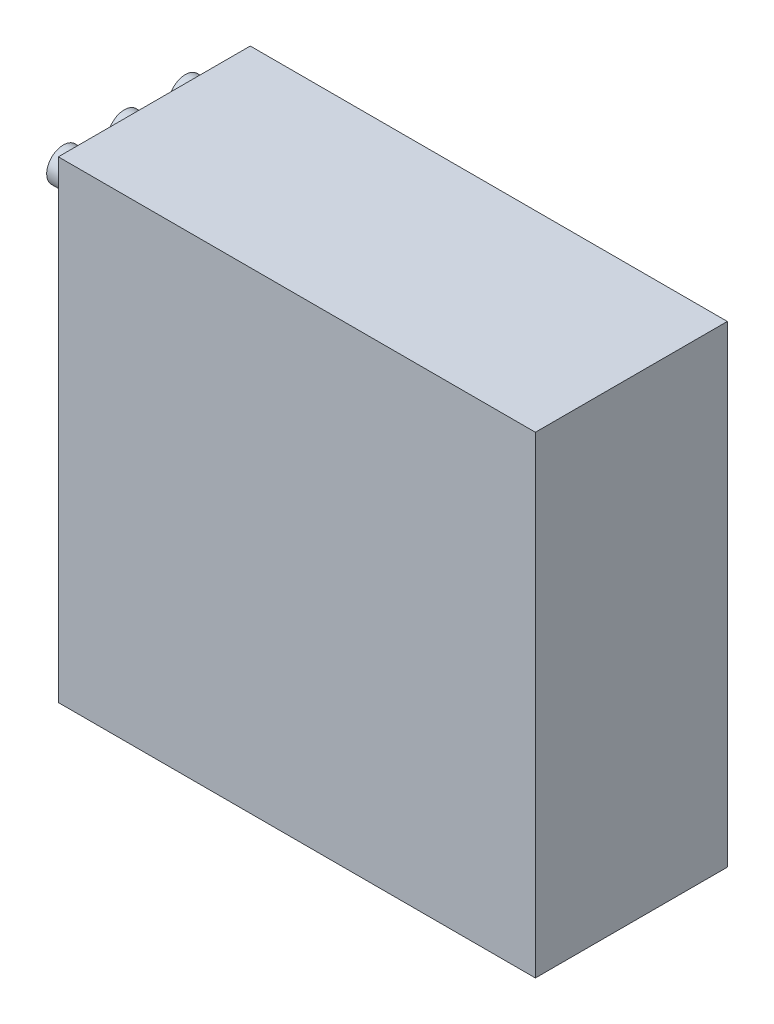
from build123d import *

# Parameters (mm, degrees)
SKETCH1_W           = 430
SKETCH1_H           = 426
BOSS_EXTRUDE1_DEPTH = 173
SKETCH2_R           = 15
BOSS_EXTRUDE2_DEPTH = 27


with BuildPart() as part:
    # Sketch1 → Boss-Extrude1 (new body)
    with BuildSketch(Plane.XY):
        with Locations((215, 213)):
            Rectangle(SKETCH1_W, SKETCH1_H)
    extrude(amount=BOSS_EXTRUDE1_DEPTH)

    # Sketch2 → Boss-Extrude2 (add)
    with BuildSketch(Plane.ZY):
        with Locations(Location((86.5, 391, 0), (0, 0, 180))):
            Circle(SKETCH2_R)
        with Locations(Location((31.5, 391, 0), (0, 0, 180))):
            Circle(SKETCH2_R)
        with Locations(Location((141.5, 391, 0), (0, 0, 180))):
            Circle(SKETCH2_R)
    extrude(amount=BOSS_EXTRUDE2_DEPTH)


solid = part.part
